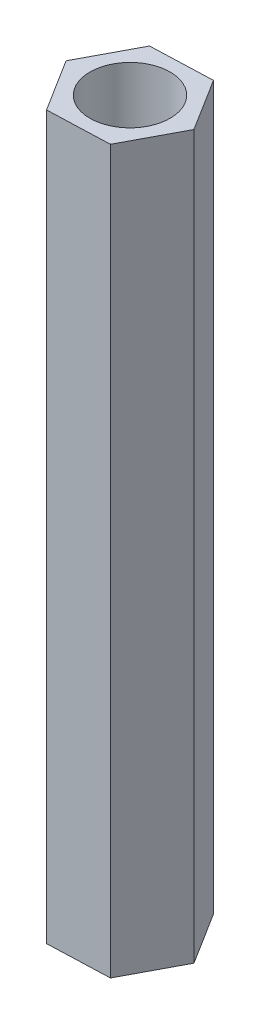
from build123d import *

# Parameters (mm, degrees)
SKETCH_1_R      = 1.5
EXTRUDE_1_DEPTH = 27


with BuildPart() as part:
    # 草图1 → 凸台-拉伸1 (new body)
    with BuildSketch(Plane(origin=(0, 0, 0), x_dir=(1, 0, 0), z_dir=(0, 1, 0))):
        Polygon((1.08184825, 2.04032784), (-1.226051617, 1.957071988), (-2.307899867, -0.083255852), (-1.08184825, -2.04032784), (1.226051617, -1.957071988), (2.307899867, 0.083255852), align=None)
        with Locations(Location((0, 0, 0), (0, 0, 270))):
            Circle(SKETCH_1_R, mode=Mode.SUBTRACT)
    extrude(amount=EXTRUDE_1_DEPTH)


solid = part.part
